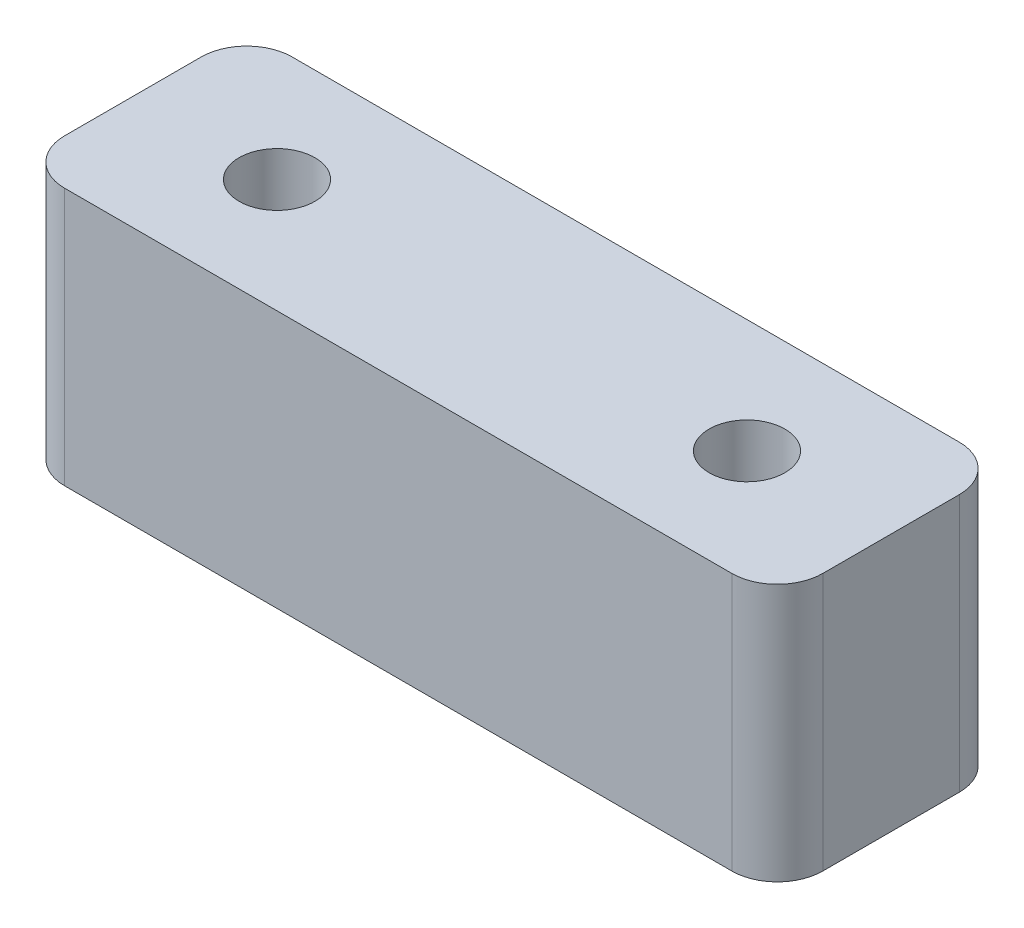
from build123d import *

# Parameters (mm, degrees)
SKETCH1_W           = 50
SKETCH1_H           = 15
BOSS_EXTRUDE1_DEPTH = 17
FILLET1_R           = 3
FILLET2_R           = 3
FILLET3_R           = 3
FILLET4_R           = 3
SKETCH2_R           = 2.5
CUT_EXTRUDE1_DEPTH  = 17


with BuildPart() as part:
    # Sketch1 → Boss-Extrude1 (new body)
    with BuildSketch(Plane(origin=(0, 0, 0), x_dir=(1, 0, 0), z_dir=(0, 1, 0))):
        with Locations((25, 7.5)):
            Rectangle(SKETCH1_W, SKETCH1_H)
    extrude(amount=BOSS_EXTRUDE1_DEPTH)

    # Fillet1
    fillet1_edges = [part.edges().sort_by_distance(p)[0] for p in [
        (50, 8.5, 0),
    ]]
    fillet(fillet1_edges, radius=FILLET1_R)

    # Fillet2
    fillet2_edges = [part.edges().sort_by_distance(p)[0] for p in [
        (50, 8.5, -15),
    ]]
    fillet(fillet2_edges, radius=FILLET2_R)

    # Fillet3
    fillet3_edges = [part.edges().sort_by_distance(p)[0] for p in [
        (0, 8.5, -15),
    ]]
    fillet(fillet3_edges, radius=FILLET3_R)

    # Fillet4
    fillet4_edges = [part.edges().sort_by_distance(p)[0] for p in [
        (0, 8.5, 0),
    ]]
    fillet(fillet4_edges, radius=FILLET4_R)

    # Sketch2 → Cut-Extrude1 (cut)
    with BuildSketch(Plane(origin=(0, 17, 0), x_dir=(1, 0, 0), z_dir=(0, 1, 0))):
        with Locations(Location((40.5, 7.5, 0), (0, 0, 270))):
            Circle(SKETCH2_R)
        with Locations(Location((9.5, 7.5, 0), (0, 0, 270))):
            Circle(SKETCH2_R)
    extrude(amount=-CUT_EXTRUDE1_DEPTH, mode=Mode.SUBTRACT)


solid = part.part
